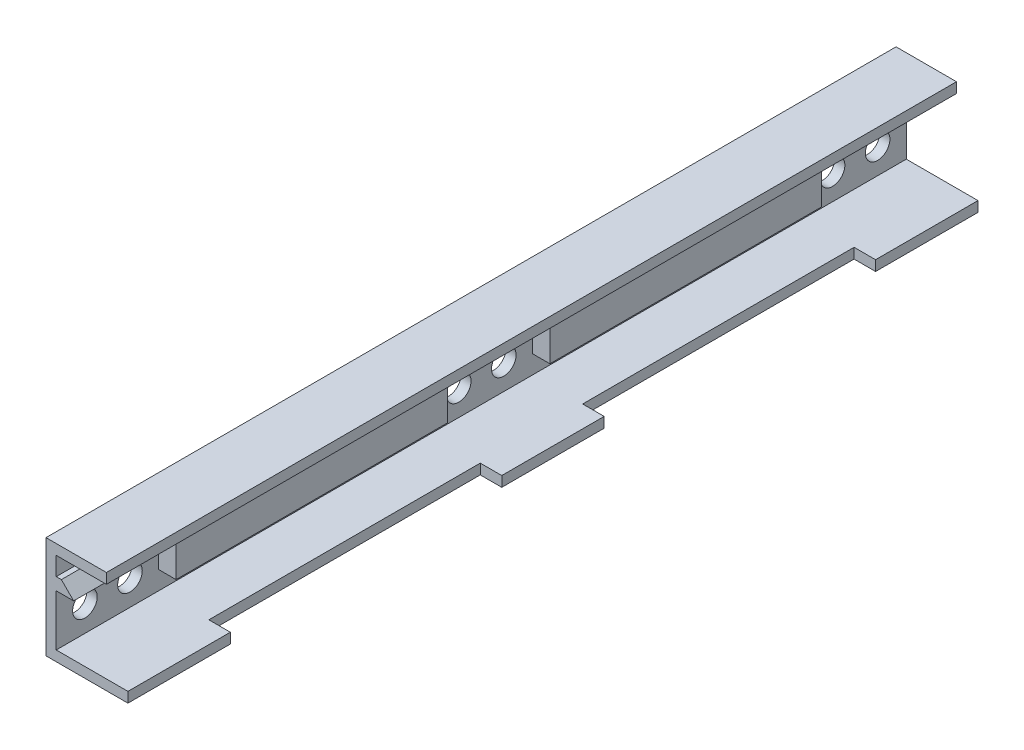
from build123d import *

# Parameters (mm, degrees)
BOSS_EXTRUDE1_DEPTH  = 10
BOSS_EXTRUDE2_DEPTH  = 26.5
BOSS_EXTRUDE3_DEPTH  = 10
BOSS_EXTRUDE4_DEPTH  = 26.5
BOSS_EXTRUDE5_DEPTH  = 10
M2_CLEARANCE_HOLE1_D = 2.4


with BuildPart() as part:
    # Sketch2 → Boss-Extrude1 (new body)
    with BuildSketch(Plane.XY):
        Polygon((0, 0), (8, 0), (8, 1), (1, 1), (1, 6), (2.7, 6), (1.5, 7.2), (1, 7.2), (1, 9), (5.9, 9), (5.9, 10), (0, 10), align=None)
    extrude(amount=BOSS_EXTRUDE1_DEPTH)

    # Sketch6 → Boss-Extrude2 (add)
    with BuildSketch(Plane.XY.offset(10)):
        Polygon((0, 0), (5.9, 0), (5.9, 1), (1, 1), (1, 2.8), (2.7, 2.8), (2.7, 6), (1.5, 7.2), (1, 7.2), (1, 9), (5.9, 9), (5.9, 10), (0, 10), align=None)
    extrude(amount=BOSS_EXTRUDE2_DEPTH)

    # Sketch8 → Boss-Extrude3 (add)
    with BuildSketch(Plane.XY.offset(36.5)):
        Polygon((0, 0), (8, 0), (8, 1), (1, 1), (1, 6), (2.7, 6), (1.5, 7.2), (1, 7.2), (1, 9), (5.9, 9), (5.9, 10), (0, 10), align=None)
    extrude(amount=BOSS_EXTRUDE3_DEPTH)

    # Sketch9 → Boss-Extrude4 (add)
    with BuildSketch(Plane.XY.offset(46.5)):
        Polygon((0, 0), (5.9, 0), (5.9, 1), (1, 1), (1, 2.8), (2.7, 2.8), (2.7, 6), (1.5, 7.2), (1, 7.2), (1, 9), (5.9, 9), (5.9, 10), (0, 10), align=None)
    extrude(amount=BOSS_EXTRUDE4_DEPTH)

    # Sketch10 → Boss-Extrude5 (add)
    with BuildSketch(Plane.XY.offset(73)):
        Polygon((0, 0), (8, 0), (8, 1), (1, 1), (1, 6), (2.7, 6), (1.5, 7.2), (1, 7.2), (1, 9), (5.9, 9), (5.9, 10), (0, 10), align=None)
    extrude(amount=BOSS_EXTRUDE5_DEPTH)

    # M2 Clearance Hole1 (through all)
    with Locations(Plane(origin=(1, 0, 0), x_dir=(0, 0, -1), z_dir=(1, 0, 0))):
        with Locations((-2.8, 3.5), (-7.2, 3.5), (-39.3, 3.5), (-43.7, 3.5), (-75.8, 3.5), (-80.2, 3.5)):
            Hole(M2_CLEARANCE_HOLE1_D / 2)


solid = part.part
